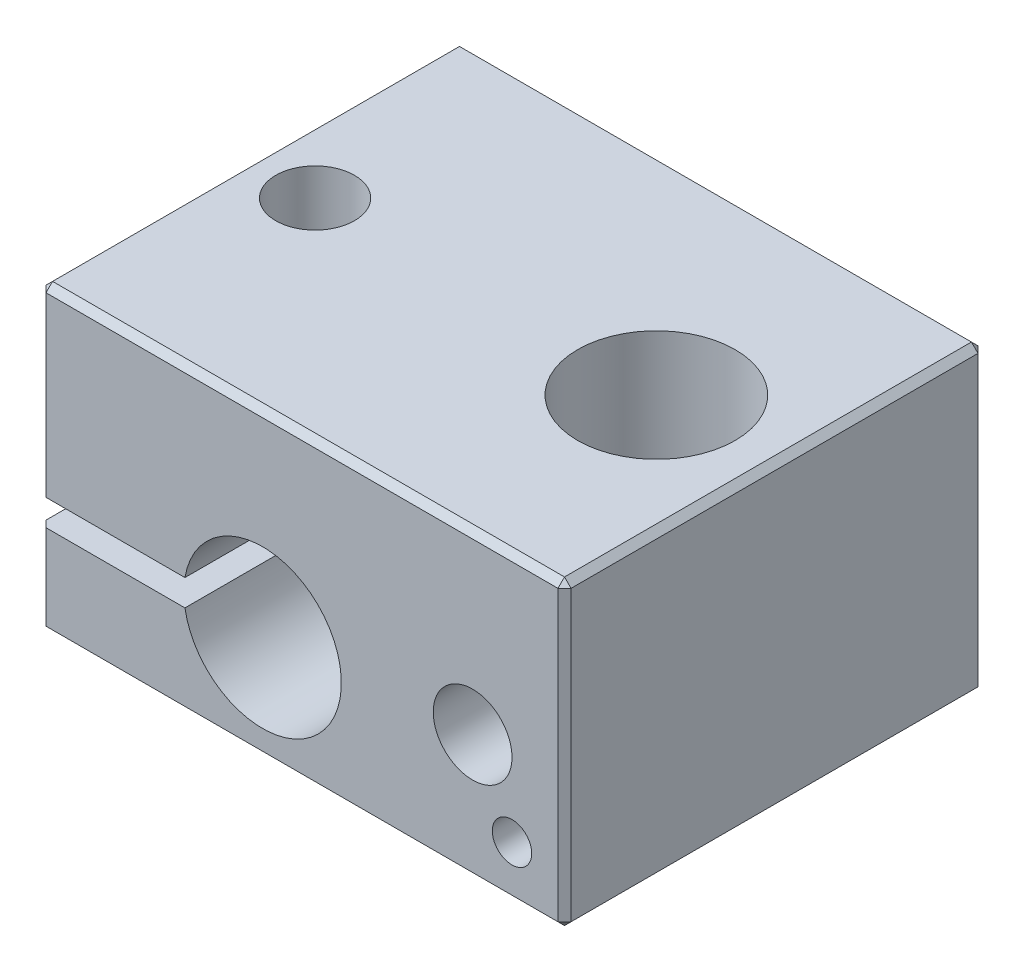
from build123d import *

# Parameters (mm, degrees)
SKETCH1_W                      = 20
SKETCH1_H                      = 16
BOSS_EXTRUDE1_DEPTH            = 11.5
CUT_EXTRUDE1_DEPTH             = 23.096379794
SKETCH3_W                      = 3
SKETCH3_H                      = 16
SKETCH4_W                      = 1.5
SKETCH4_H                      = 7
F_6_0_6_DIAMETER_HOLE1_D       = 6
F_3_0_3_DIAMETER_HOLE2_D       = 3
F_3_0_3_DIAMETER_HOLE3_D       = 3
F_3_0_3_DIAMETER_HOLE3_DEPTH   = 3.5
F_1_5_1_5_DIAMETER_HOLE1_D     = 1.5
F_1_5_1_5_DIAMETER_HOLE1_DEPTH = 4.5
CHAMFER1_SIZE                  = 0.25


with BuildPart() as part:
    # Sketch1 → Boss-Extrude1 (new body)
    with BuildSketch(Plane.XZ):
        Rectangle(SKETCH1_W, SKETCH1_H)
    extrude(amount=-BOSS_EXTRUDE1_DEPTH)

    # Sketch2 → Cut-Extrude1 (cut, through all)
    with BuildSketch(Plane(origin=(0, 0, -8), x_dir=(-1, 0, 0), z_dir=(0, 0, -1))):
        with BuildLine():
            Line((10, 3.5), (10, 4.5))
            Line((10, 4.5), (4.458039892, 4.5))
            ThreePointArc((4.458039892, 4.5), (4.5, 4), (4.458039892, 3.5))
            Line((4.458039892, 3.5), (10, 3.5))
        make_face()
    extrude(amount=-CUT_EXTRUDE1_DEPTH, mode=Mode.SUBTRACT)

    # Sketch3 → Cut-Revolve1 (revolve, cut)
    with BuildSketch(Plane(origin=(0, 4, 0), x_dir=(1, 0, 0), z_dir=(0, 1, 0))):
        Rectangle(SKETCH3_W, SKETCH3_H)
    revolve(axis=Axis((-1.5, 4, -8), (0, 0, 1)), mode=Mode.SUBTRACT)

    # Sketch4 → Ø3.0 (3) Diameter Hole1 (revolve, cut)
    with BuildSketch(Plane(origin=(-7.5, 4.5, 0), x_dir=(0, 0, -1), z_dir=(1, 0, 0))):
        with Locations((0.75, 3.5)):
            Rectangle(SKETCH4_W, SKETCH4_H)
    revolve(axis=Axis((-7.5, -1.85, 0), (0, 1, 0)), mode=Mode.SUBTRACT)

    # Ø6.0 (6) Diameter Hole1 (through all)
    with Locations(Plane(origin=(0, 0, 0), x_dir=(-1, 0, 0), z_dir=(0, -1, 0))):
        with Locations((-5.5, 0)):
            Hole(F_6_0_6_DIAMETER_HOLE1_D / 2)

    # Ø3.0 (3) Diameter Hole2 (through all)
    with Locations(Plane(origin=(0, 3.5, 0), x_dir=(1, 0, 0), z_dir=(0, 1, 0))):
        with Locations((-7.5, 0)):
            Hole(F_3_0_3_DIAMETER_HOLE2_D / 2)

    # Ø3.0 (3) Diameter Hole3
    with Locations(Plane.XY.offset(8)):
        with Locations((6.5, 4.8)):
            Hole(F_3_0_3_DIAMETER_HOLE3_D / 2, depth=F_3_0_3_DIAMETER_HOLE3_DEPTH)

    # Ø1.5 (1.5) Diameter Hole1
    with Locations(Plane.XY.offset(8)):
        with Locations((8, 2)):
            Hole(F_1_5_1_5_DIAMETER_HOLE1_D / 2, depth=F_1_5_1_5_DIAMETER_HOLE1_DEPTH)

    # Chamfer1
    chamfer1_edges = [part.edges().sort_by_distance(p)[0] for p in [
        (0, 11.5, 8),
        (-10, 11.5, 0),
        (-10, 1.75, 8),
        (-10, 1.75, -8),
        (0, 11.5, -8),
        (-10, 0, 0),
        (0, 0, 8),
        (10, 0, 0),
        (0, 0, -8),
        (10, 11.5, 0),
        (-10, 8, -8),
        (-10, 8, 8),
        (10, 5.75, 8),
        (10, 5.75, -8),
    ]]
    chamfer(chamfer1_edges, length=CHAMFER1_SIZE)


solid = part.part
